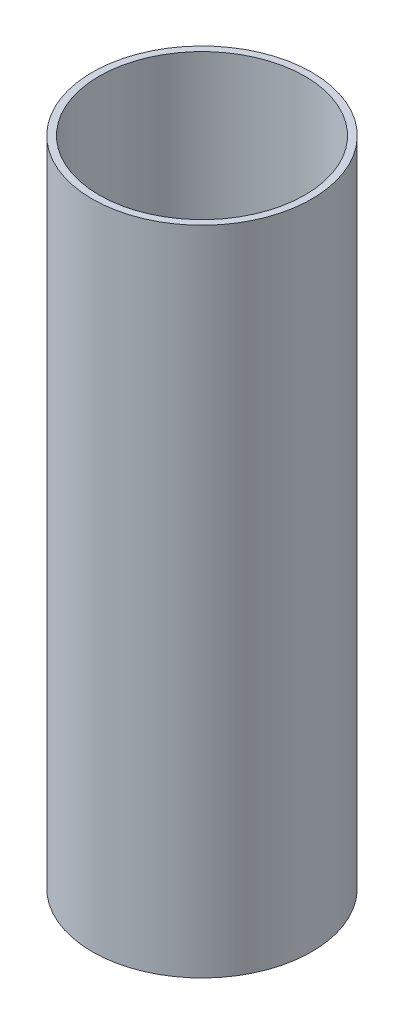
from build123d import *

# Parameters (mm, degrees)
SKETCH1_R           = 16
SKETCH1_R_2         = 15
BOSS_EXTRUDE1_DEPTH = 85
BOSS_EXTRUDE2_START = -10
SKETCH4_R           = 16
SKETCH4_R_2         = 15
BOSS_EXTRUDE2_DEPTH = 10


with BuildPart() as part:
    # Sketch1 → Boss-Extrude1 (new body)
    with BuildSketch(Plane(origin=(0, 0, 0), x_dir=(1, 0, 0), z_dir=(0, 1, 0))):
        with Locations(Location((0, 0, 0), (0, 0, 270))):
            Circle(SKETCH1_R)
        with Locations(Location((0, 0, 0), (0, 0, 270))):
            Circle(SKETCH1_R_2, mode=Mode.SUBTRACT)
    extrude(amount=BOSS_EXTRUDE1_DEPTH)

    # Sketch4 → Boss-Extrude2 (add)
    with BuildSketch(Plane(origin=(0, 0, 0), x_dir=(1, 0, 0), z_dir=(0, 1, 0)).offset(BOSS_EXTRUDE2_START)):
        with Locations(Location((0, 0, 0), (0, 0, 270))):
            Circle(SKETCH4_R)
        with Locations(Location((0, 0, 0), (0, 0, 270))):
            Circle(SKETCH4_R_2, mode=Mode.SUBTRACT)
    extrude(amount=BOSS_EXTRUDE2_DEPTH)


solid = part.part
